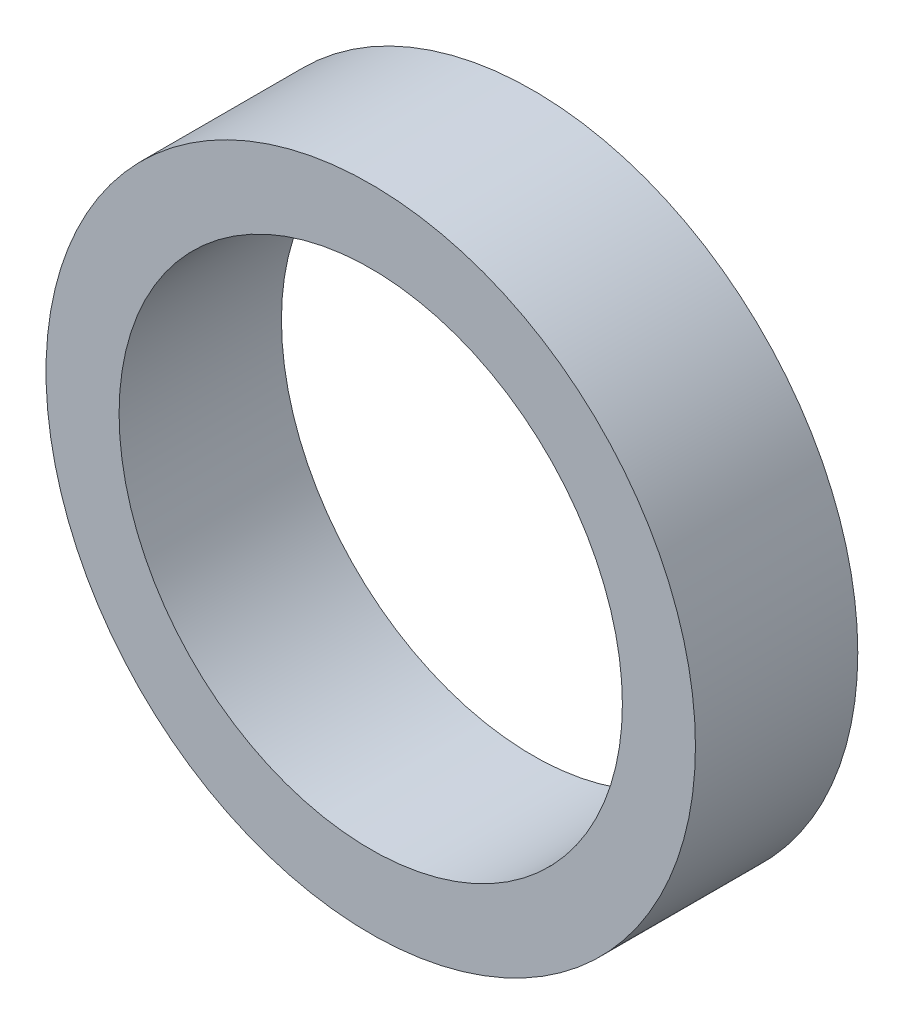
from build123d import *

# Parameters (mm, degrees)
SKETCH1_R           = 2
SKETCH1_R_2         = 1.55
BOSS_EXTRUDE1_DEPTH = 1


with BuildPart() as part:
    # Sketch1 → Boss-Extrude1 (new body)
    with BuildSketch(Plane.XY):
        Circle(SKETCH1_R)
        Circle(SKETCH1_R_2, mode=Mode.SUBTRACT)
    extrude(amount=BOSS_EXTRUDE1_DEPTH)


solid = part.part
